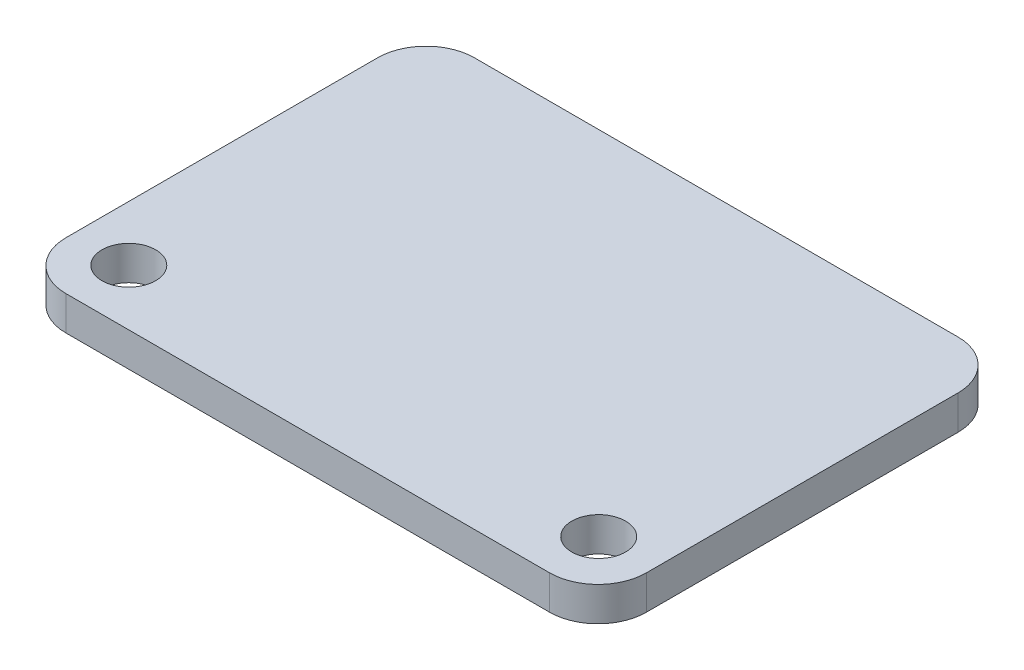
from build123d import *

# Parameters (mm, degrees)
SKETCH1_W           = 27
SKETCH1_H           = 19
BOSS_EXTRUDE1_DEPTH = 1.5875
FILLET1_R           = 2.25
SKETCH3_R           = 1.25
CUT_EXTRUDE1_DEPTH  = 17.583731674


with BuildPart() as part:
    # Sketch1 → Boss-Extrude1 (new body)
    with BuildSketch(Plane(origin=(0, 0, 0), x_dir=(1, 0, 0), z_dir=(0, 1, 0))):
        Rectangle(SKETCH1_W, SKETCH1_H)
    extrude(amount=BOSS_EXTRUDE1_DEPTH)

    # Fillet1
    fillet1_edges = [part.edges().sort_by_distance(p)[0] for p in [
        (13.5, 0.79375, 9.5),
        (-13.5, 0.79375, 9.5),
        (-13.5, 0.79375, -9.5),
        (13.5, 0.79375, -9.5),
    ]]
    fillet(fillet1_edges, radius=FILLET1_R)

    # Sketch3 → Cut-Extrude1 (cut, through all)
    with BuildSketch(Plane(origin=(0, 1.5875, 0), x_dir=(1, 0, 0), z_dir=(0, 1, 0))):
        with Locations(Location((-10.929036637, -6.89606103, 0), (0, 0, 270))):
            Circle(SKETCH3_R)
        with Locations(Location((10.929036637, -6.89606103, 0), (0, 0, 270))):
            Circle(SKETCH3_R)
    extrude(amount=-CUT_EXTRUDE1_DEPTH, mode=Mode.SUBTRACT)


solid = part.part
